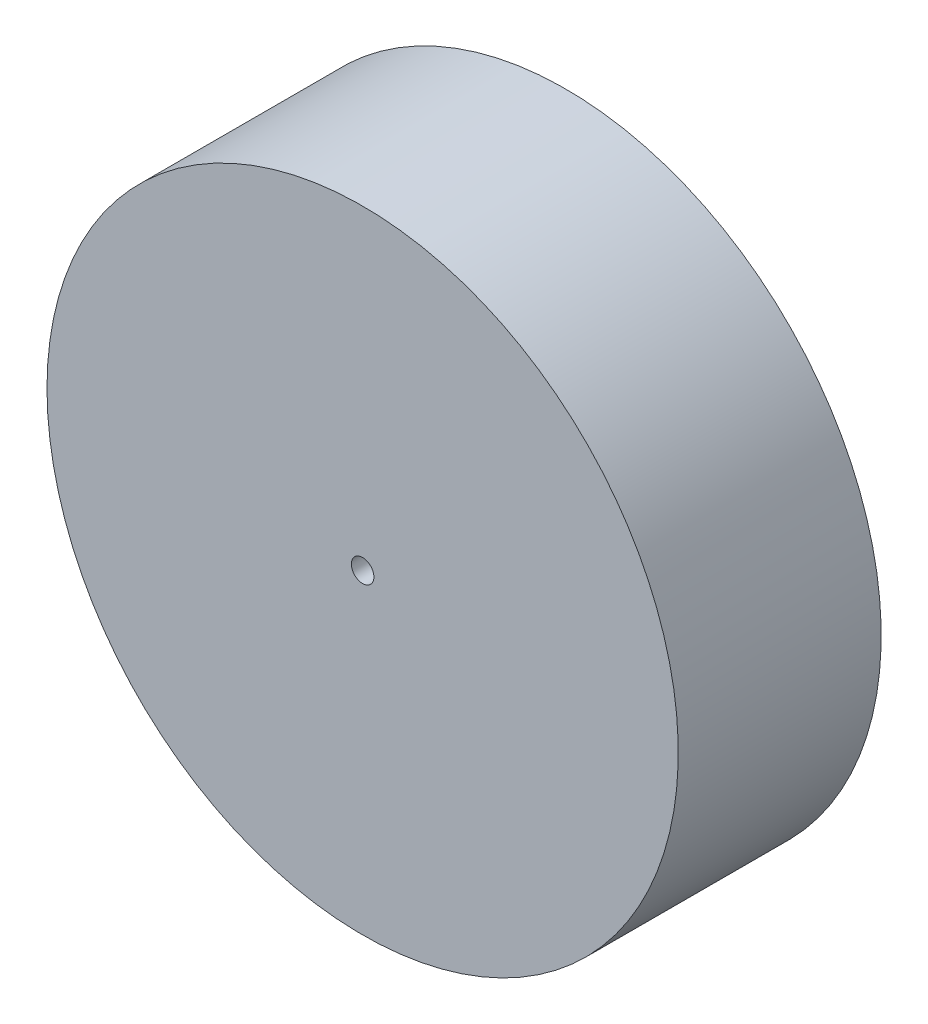
from build123d import *

# Parameters (mm, degrees)
SKETCH1_R           = 70
BOSS_EXTRUDE1_DEPTH = 45
SKETCH3_R           = 2.5
CUT_EXTRUDE1_DEPTH  = 20


with BuildPart() as part:
    # Sketch1 → Boss-Extrude1 (new body)
    with BuildSketch(Plane.XY):
        with Locations(Location((0, 0, 0), (0, 0, 180))):
            Circle(SKETCH1_R)
    extrude(amount=BOSS_EXTRUDE1_DEPTH)

    # Sketch3 → Cut-Extrude1 (cut)
    with BuildSketch(Plane.XY.offset(45)):
        Circle(SKETCH3_R)
    extrude(amount=-CUT_EXTRUDE1_DEPTH, mode=Mode.SUBTRACT)


solid = part.part
